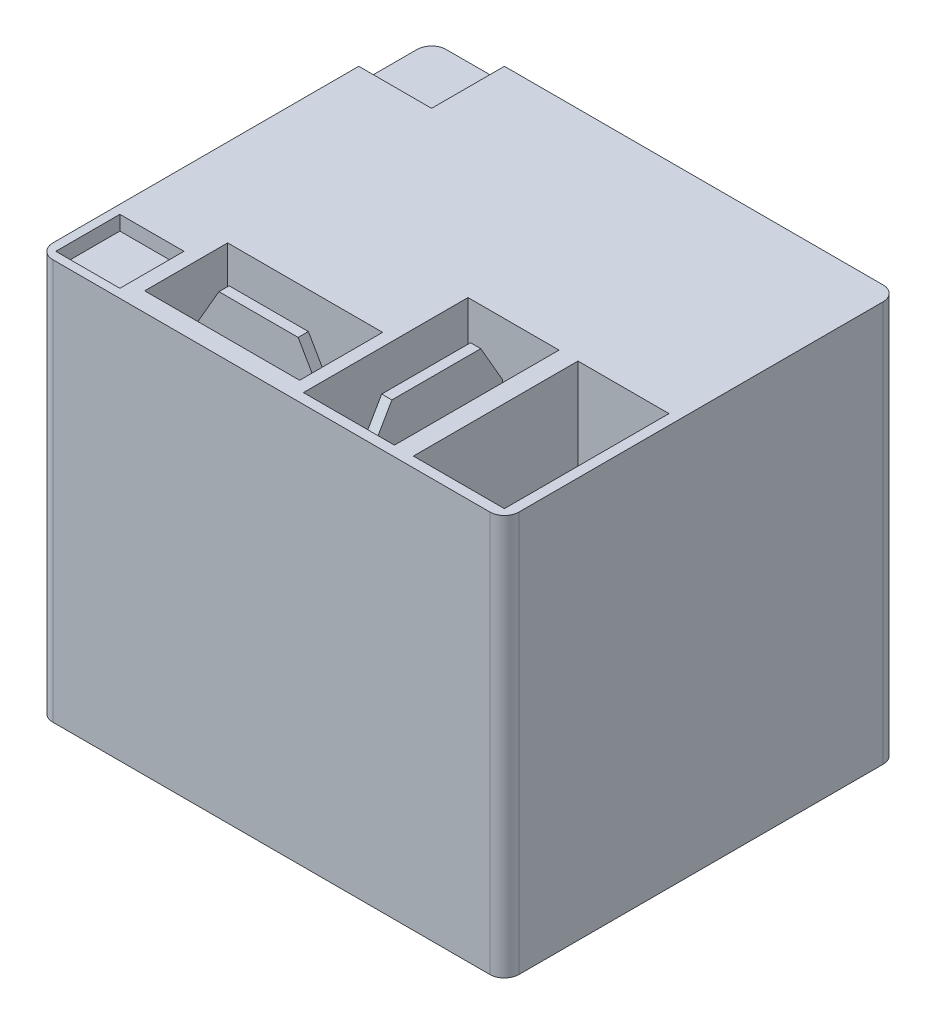
from build123d import *

# Parameters (mm, degrees)
SKETCH1_W             = 32
SKETCH1_H             = 27
BOSS_EXTRUDE1_DEPTH   = 27.5
SKETCH2_W             = 10.64
SKETCH2_H             = 5.7
SKETCH2_W_2           = 6.25
SKETCH2_H_2           = 11.3
CUT_EXTRUDE1_DEPTH    = 9.3
SKETCH3_W             = 4.4
SKETCH3_H             = 4.4
SKETCH3_W_2           = 5
SKETCH3_H_2           = 5
CUT_EXTRUDE2_DEPTH    = 1
SKETCH4_W             = 8.44
SKETCH4_H             = 0.7
BOSS_EXTRUDE2_DEPTH   = 9.3
SKETCH4_W_2           = 0.7
SKETCH4_H_2           = 9.1
BOSS_EXTRUDE2_2_DEPTH = 9.3
CHAMFER1_SIZE         = 1.5
CHAMFER1_SIZE2        = 2.598076211
CHAMFER2_SIZE         = 1.5
CHAMFER2_SIZE2        = 2.598076211
FILLET1_R             = 1
SKETCH5_R             = 0.35
BOSS_EXTRUDE3_DEPTH   = 4.25
BOSS_EXTRUDE3_2_DEPTH = 4.25
SKETCH5_R_2           = 0.6
BOSS_EXTRUDE3_3_DEPTH = 4.25
BOSS_EXTRUDE3_4_DEPTH = 4.25


with BuildPart() as part:
    # Sketch1 → Boss-Extrude1 (new body)
    with BuildSketch(Plane(origin=(0, 0, 0), x_dir=(1, 0, 0), z_dir=(0, 1, 0))):
        with Locations((16, 13.5)):
            Rectangle(SKETCH1_W, SKETCH1_H)
    extrude(amount=BOSS_EXTRUDE1_DEPTH)

    # Sketch2 → Cut-Extrude1 (cut)
    with BuildSketch(Plane(origin=(0, 27.5, 0), x_dir=(1, 0, 0), z_dir=(0, 1, 0))):
        with Locations((11.32, 4.15)):
            Rectangle(SKETCH2_W, SKETCH2_H)
        with Locations((20.625, 6.35)):
            Rectangle(SKETCH2_W_2, SKETCH2_H_2)
        with Locations((28.175, 6.35)):
            Rectangle(SKETCH2_W_2, SKETCH2_H_2)
    extrude(amount=-CUT_EXTRUDE1_DEPTH, mode=Mode.SUBTRACT)

    # Sketch3 → Cut-Extrude2 (cut)
    with BuildSketch(Plane(origin=(0, 27.5, 0), x_dir=(1, 0, 0), z_dir=(0, 1, 0))):
        with Locations((2.8, 2.8)):
            Rectangle(SKETCH3_W, SKETCH3_H)
        with Locations((2.5, 24.5)):
            Rectangle(SKETCH3_W_2, SKETCH3_H_2)
    extrude(amount=-CUT_EXTRUDE2_DEPTH, mode=Mode.SUBTRACT)

    # Fillet1
    fillet1_edges = [part.edges().sort_by_distance(p)[0] for p in [
        (0, 13.25, -27),
        (32, 13.75, -27),
        (32, 13.75, 0),
        (0, 13.75, 0),
    ]]
    fillet(fillet1_edges, radius=FILLET1_R)


with BuildPart() as body_2:
    # Sketch4 → Boss-Extrude2 (new body)
    with BuildSketch(Plane(origin=(0, 18.2, 0), x_dir=(1, 0, 0), z_dir=(0, 1, 0))):
        with Locations((11.32, 4.15)):
            Rectangle(SKETCH4_W, SKETCH4_H)
    extrude(amount=BOSS_EXTRUDE2_DEPTH)

    # Chamfer1
    chamfer1_edges = [body_2.edges().sort_by_distance(p)[0] for p in [
        (15.54, 27.5, -4.15),
        (7.1, 27.5, -4.15),
    ]]
    chamfer1_side = [body_2.faces().sort_by_distance(p)[0] for p in [
        (11.32, 27.5, -4.15),
    ]]
    chamfer(chamfer1_edges, length=CHAMFER1_SIZE, length2=CHAMFER1_SIZE2, reference=chamfer1_side[0])


with BuildPart() as body_3:
    # Sketch4 → Boss-Extrude2 2 (new body)
    with BuildSketch(Plane(origin=(0, 18.2, 0), x_dir=(1, 0, 0), z_dir=(0, 1, 0))):
        with Locations((20.625, 6.35)):
            Rectangle(SKETCH4_W_2, SKETCH4_H_2)
    extrude(amount=BOSS_EXTRUDE2_2_DEPTH)

    # Chamfer2
    chamfer2_edges = [body_3.edges().sort_by_distance(p)[0] for p in [
        (20.625, 27.5, -10.9),
        (20.625, 27.5, -1.8),
    ]]
    chamfer2_side = [body_3.faces().sort_by_distance(p)[0] for p in [
        (20.625, 27.5, -6.35),
    ]]
    chamfer(chamfer2_edges, length=CHAMFER2_SIZE, length2=CHAMFER2_SIZE2, reference=chamfer2_side[0])


with BuildPart() as body_4:
    # Sketch5 → Boss-Extrude3 (new body)
    with BuildSketch(Plane.XZ):
        with Locations(Location((5.7, -19.6, 0), (0, 0, 270))):
            Circle(SKETCH5_R)
    extrude(amount=BOSS_EXTRUDE3_DEPTH)


with BuildPart() as body_5:
    # Sketch5 → Boss-Extrude3 2 (new body)
    with BuildSketch(Plane.XZ):
        with Locations(Location((5.7, -10, 0), (0, 0, 270))):
            Circle(SKETCH5_R)
    extrude(amount=BOSS_EXTRUDE3_2_DEPTH)


with BuildPart() as body_6:
    # Sketch5 → Boss-Extrude3 3 (new body)
    with BuildSketch(Plane.XZ):
        with Locations(Location((19, -24, 0), (0, 0, 270))):
            Circle(SKETCH5_R_2)
    extrude(amount=BOSS_EXTRUDE3_3_DEPTH)


with BuildPart() as body_7:
    # Sketch5 → Boss-Extrude3 4 (new body)
    with BuildSketch(Plane.XZ):
        with Locations(Location((21.5, -5.3, 0), (0, 0, 270))):
            Circle(SKETCH5_R_2)
    extrude(amount=BOSS_EXTRUDE3_4_DEPTH)


solid = Compound([part.part, body_2.part, body_3.part, body_4.part, body_5.part, body_6.part, body_7.part])
